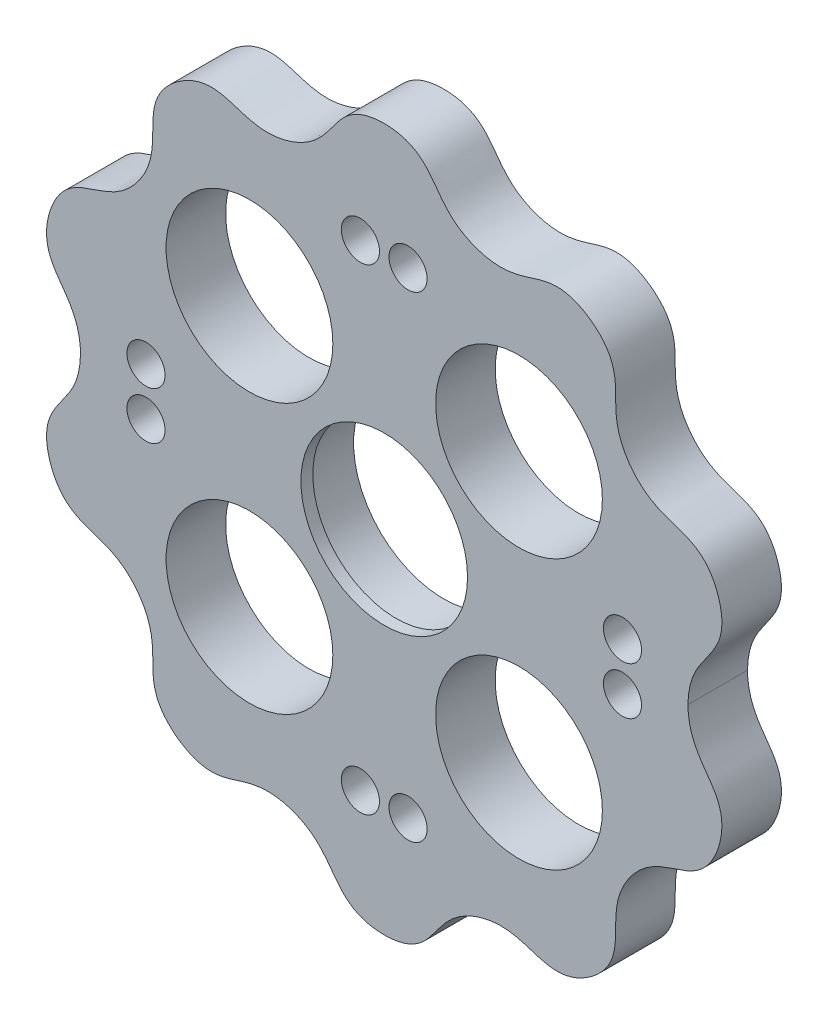
from build123d import *

# Parameters (mm, degrees)
SKETCH3_R                  = 7.5
CYC_DISK_DEPTH             = 5
SKETCH6_R                  = 7.575
CAM_BEARING_DEPTH          = 43.617229285
SKETCH7_R                  = 7
OUTPUT_HOLES_DEPTH         = 43.617229285
SKETCH8_R                  = 7.575
SKETCH8_R_2                = 6.995336342
CAM_BEARING_RETAINER_DEPTH = 1
SKETCH9_R                  = 1.6
POSITIONING_HOLES_DEPTH    = 43.617229285


with BuildPart() as part:
    # Sketch3 → CYC Disk (new body)
    with BuildSketch(Plane.XY.offset(4)):
        with BuildLine():
            add(Edge.make_bspline(
                [(-23.5, 0), (-23.500000004, -0.661850826), (-23.598485334, -1.456071804), (-23.887378462, -2.473353009), (-24.526473508, -3.480254489), (-25.323926988, -4.542764949), (-25.759943157, -5.192186221), (-26.203023639, -6.106999259), (-26.399245523, -6.974680154), (-26.368470738, -8.175748768), (-26.032181523, -9.410596043), (-25.46714701, -10.517898357), (-24.88950703, -11.225581762), (-23.980221887, -11.908283091), (-23.157605578, -12.27234585), (-21.75724169, -12.686961807), (-20.124240836, -13.267572581), (-18.769902135, -14.583261804), (-17.725881209, -16.190526715), (-17.393334278, -18.002161758), (-17.43929245, -19.341809491), (-17.428782036, -20.39238515), (-17.227121316, -21.51798755), (-16.875858121, -22.335292469), (-16.144990379, -23.288888425), (-15.147101673, -24.090235015), (-14.039123179, -24.653942451), (-13.15583675, -24.886942091), (-12.018927843, -24.904794671), (-11.139426548, -24.715805895), (-9.76280322, -24.22812401), (-8.100403327, -23.737994173), (-6.23137758, -24.006348799), (-4.442020297, -24.692993323), (-3.108131817, -25.963170679), (-2.357887579, -27.073981998), (-1.731871597, -27.917737693), (-0.907112157, -28.709835967), (-0.142534485, -29.16458221), (1.009259579, -29.506464264), (2.287588208, -29.568223008), (3.515300557, -29.373018486), (4.366848041, -29.042336417), (5.297120151, -28.388521169), (5.89756683, -27.718668148), (6.724626277, -26.514966324), (7.781444952, -25.141308816), (9.451253436, -24.259826499), (11.302473412, -23.763575766), (13.128203378, -24.007130856), (14.388082228, -24.464813592), (15.39048695, -24.779463326), (16.523315038, -24.935502855), (17.409164503, -24.853992814), (18.541938704, -24.453573642), (19.612429169, -23.752154799), (20.490930983, -22.872599811), (20.985477327, -22.104545345), (21.353780313, -21.028797471), (21.445822153, -20.13394129), (21.40740912, -18.673992713), (21.454977764, -16.941498013), (22.287758898, -15.246875037), (23.493738457, -13.75727996), (25.113943117, -12.881183019), (26.402225679, -12.510917922), (27.398134609, -12.176276192), (28.406329517, -11.63665518), (29.075086389, -11.05002292), (29.756159484, -10.060249035), (30.209920811, -8.863570763), (30.403654258, -7.63562542), (30.352299566, -6.723569256), (30.017954205, -5.636787881), (29.566434352, -4.858733188), (28.677221314, -3.700188592), (27.92348978, -2.600513359), (27.598485315, -1.456071829), (27.499999996, -0.661850826), (27.5, 0)],
                knots=[0.5, 0.5, 0.5, 0.5, 0.5, 0.5, 0.516666667, 0.52, 0.526666667, 0.53, 0.533333333, 0.536666667, 0.546666667, 0.55, 0.56, 0.563333333, 0.566666667, 0.57, 0.58, 0.583333333, 0.6, 0.61, 0.616666667, 0.626666667, 0.63, 0.633333333, 0.636666667, 0.646666667, 0.65, 0.66, 0.663333333, 0.666666667, 0.67, 0.68, 0.683333333, 0.7, 0.71, 0.716666667, 0.726666667, 0.73, 0.733333333, 0.736666667, 0.746666667, 0.75, 0.76, 0.763333333, 0.766666667, 0.77, 0.78, 0.783333333, 0.8, 0.81, 0.816666667, 0.826666667, 0.83, 0.833333333, 0.836666667, 0.846666667, 0.85, 0.86, 0.863333333, 0.866666667, 0.87, 0.88, 0.883333333, 0.9, 0.91, 0.916666667, 0.926666667, 0.93, 0.933333333, 0.936666667, 0.946666667, 0.95, 0.96, 0.963333333, 0.966666667, 0.97, 0.98, 0.983333333, 1, 1, 1, 1, 1, 1], degree=5, weights=[1, 1, 1, 1, 1, 1, 1, 1, 1, 1, 1, 1, 1, 1, 1, 1, 1, 1, 1, 1, 1, 1, 1, 1, 1, 1, 1, 1, 1, 1, 1, 1, 1, 1, 1, 1, 1, 1, 1, 1, 1, 1, 1, 1, 1, 1, 1, 1, 1, 1, 1, 1, 1, 1, 1, 1, 1, 1, 1, 1, 1, 1, 1, 1, 1, 1, 1, 1, 1, 1, 1, 1, 1, 1, 1, 1, 1, 1, 1, 1]))
            add(Edge.make_bspline(
                [(27.5, 0), (27.500000004, 0.661850826), (27.598485335, 1.456071804), (27.887378462, 2.473353009), (28.526473508, 3.480254489), (29.323926988, 4.542764949), (29.759943157, 5.192186221), (30.203023639, 6.106999259), (30.399245523, 6.974680154), (30.368470738, 8.175748768), (30.032181523, 9.410596043), (29.46714701, 10.517898357), (28.88950703, 11.225581762), (27.980221887, 11.908283091), (27.157605578, 12.27234585), (25.75724169, 12.686961807), (24.124240836, 13.267572581), (22.769902135, 14.583261804), (21.725881209, 16.190526715), (21.393334278, 18.002161758), (21.43929245, 19.341809491), (21.428782036, 20.39238515), (21.227121316, 21.51798755), (20.875858121, 22.335292469), (20.144990379, 23.288888425), (19.147101673, 24.090235015), (18.039123179, 24.653942451), (17.15583675, 24.886942091), (16.018927843, 24.904794671), (15.139426548, 24.715805895), (13.76280322, 24.22812401), (12.100403327, 23.737994173), (10.23137758, 24.006348799), (8.442020297, 24.692993323), (7.108131817, 25.963170679), (6.357887579, 27.073981998), (5.731871597, 27.917737693), (4.907112157, 28.709835967), (4.142534485, 29.16458221), (2.990740421, 29.506464264), (1.712411792, 29.568223008), (0.484699443, 29.373018486), (-0.366848041, 29.042336417), (-1.297120151, 28.388521169), (-1.89756683, 27.718668148), (-2.724626277, 26.514966324), (-3.781444952, 25.141308816), (-5.451253436, 24.259826499), (-7.302473412, 23.763575766), (-9.128203378, 24.007130856), (-10.388082228, 24.464813592), (-11.39048695, 24.779463326), (-12.523315038, 24.935502855), (-13.409164503, 24.853992814), (-14.541938704, 24.453573642), (-15.612429169, 23.752154799), (-16.490930983, 22.872599811), (-16.985477327, 22.104545345), (-17.353780313, 21.028797471), (-17.445822153, 20.13394129), (-17.40740912, 18.673992713), (-17.454977764, 16.941498013), (-18.287758898, 15.246875037), (-19.493738457, 13.75727996), (-21.113943117, 12.881183019), (-22.402225679, 12.510917922), (-23.398134609, 12.176276192), (-24.406329517, 11.63665518), (-25.075086389, 11.05002292), (-25.756159484, 10.060249035), (-26.209920811, 8.863570763), (-26.403654258, 7.63562542), (-26.352299566, 6.723569256), (-26.017954205, 5.636787881), (-25.566434352, 4.858733188), (-24.677221314, 3.700188592), (-23.92348978, 2.600513359), (-23.598485314, 1.456071829), (-23.499999996, 0.661850826), (-23.5, 0)],
                knots=[0, 0, 0, 0, 0, 0, 0.016666667, 0.02, 0.026666667, 0.03, 0.033333333, 0.036666667, 0.046666667, 0.05, 0.06, 0.063333333, 0.066666667, 0.07, 0.08, 0.083333333, 0.1, 0.11, 0.116666667, 0.126666667, 0.13, 0.133333333, 0.136666667, 0.146666667, 0.15, 0.16, 0.163333333, 0.166666667, 0.17, 0.18, 0.183333333, 0.2, 0.21, 0.216666667, 0.226666667, 0.23, 0.233333333, 0.236666667, 0.246666667, 0.25, 0.26, 0.263333333, 0.266666667, 0.27, 0.28, 0.283333333, 0.3, 0.31, 0.316666667, 0.326666667, 0.33, 0.333333333, 0.336666667, 0.346666667, 0.35, 0.36, 0.363333333, 0.366666667, 0.37, 0.38, 0.383333333, 0.4, 0.41, 0.416666667, 0.426666667, 0.43, 0.433333333, 0.436666667, 0.446666667, 0.45, 0.46, 0.463333333, 0.466666667, 0.47, 0.48, 0.483333333, 0.5, 0.5, 0.5, 0.5, 0.5, 0.5], degree=5, weights=[1, 1, 1, 1, 1, 1, 1, 1, 1, 1, 1, 1, 1, 1, 1, 1, 1, 1, 1, 1, 1, 1, 1, 1, 1, 1, 1, 1, 1, 1, 1, 1, 1, 1, 1, 1, 1, 1, 1, 1, 1, 1, 1, 1, 1, 1, 1, 1, 1, 1, 1, 1, 1, 1, 1, 1, 1, 1, 1, 1, 1, 1, 1, 1, 1, 1, 1, 1, 1, 1, 1, 1, 1, 1, 1, 1, 1, 1, 1, 1]))
        make_face()
        with Locations((2, 0)):
            Circle(SKETCH3_R, mode=Mode.SUBTRACT)
    extrude(amount=CYC_DISK_DEPTH)

    # Sketch6 → Cam Bearing (cut, through all)
    with BuildSketch(Plane.XY.offset(9)):
        with Locations((2, 0)):
            Circle(SKETCH6_R)
    extrude(amount=-CAM_BEARING_DEPTH, mode=Mode.SUBTRACT)

    # Sketch7 → Output Holes (cut, through all)
    with BuildSketch(Plane.XY.offset(9)):
        with Locations((13.313708499, 11.313708499)):
            Circle(SKETCH7_R)
        with Locations((13.313708499, -11.313708499)):
            Circle(SKETCH7_R)
        with Locations((-9.313708499, -11.313708499)):
            Circle(SKETCH7_R)
        with Locations((-9.313708499, 11.313708499)):
            Circle(SKETCH7_R)
    extrude(amount=-OUTPUT_HOLES_DEPTH, mode=Mode.SUBTRACT)

    # Sketch8 → Cam Bearing Retainer (add)
    with BuildSketch(Plane.XY.offset(9)):
        with Locations((2, 0)):
            Circle(SKETCH8_R)
        with Locations((2, 0)):
            Circle(SKETCH8_R_2, mode=Mode.SUBTRACT)
    extrude(amount=-CAM_BEARING_RETAINER_DEPTH)

    # Sketch9 → Positioning Holes (cut, through all)
    with BuildSketch(Plane.XY.offset(9)):
        with Locations((0, 20)):
            Circle(SKETCH9_R)
        with Locations((4, 20)):
            Circle(SKETCH9_R)
        with Locations((22, -2)):
            Circle(SKETCH9_R)
        with Locations((22, 2)):
            Circle(SKETCH9_R)
        with Locations((0, -20)):
            Circle(SKETCH9_R)
        with Locations((4, -20)):
            Circle(SKETCH9_R)
        with Locations((-18, 2)):
            Circle(SKETCH9_R)
        with Locations((-18, -2)):
            Circle(SKETCH9_R)
    extrude(amount=-POSITIONING_HOLES_DEPTH, mode=Mode.SUBTRACT)


solid = part.part
